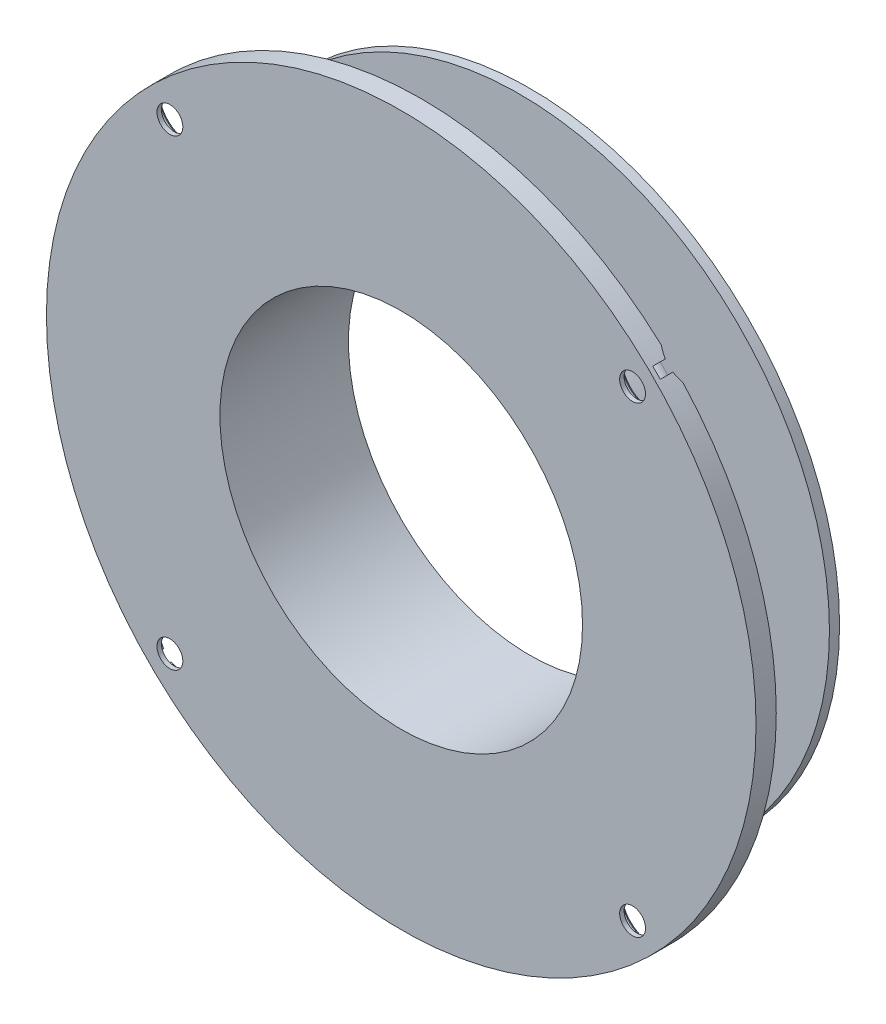
from build123d import *

# Parameters (mm, degrees)
CBORE_FOR_10_BINDING_HEAD_MACHINE_S_2_COUNT = 2
CBORE_FOR_10_BINDING_HEAD_MACHINE_S_2_PITCH = 91.44
CBORE_FOR_10_BINDING_HEAD_MACHINE_S_3_COUNT = 2
CBORE_FOR_10_BINDING_HEAD_MACHINE_S_3_PITCH = 129.315688143
CBORE_FOR_10_BINDING_HEAD_MACHINE_S_4_COUNT = 2
CBORE_FOR_10_BINDING_HEAD_MACHINE_S_4_PITCH = 91.44


with BuildPart() as part:
    # Sketch1 → Revolve1 (revolve)
    with BuildSketch(Plane(origin=(0, 0, 0), x_dir=(1, 0, 0), z_dir=(0, 1, 0)), mode=Mode.PRIVATE) as revolve1_sk:
        with BuildLine():
            Line((-1.000000064, -24.96), (-1.000000064, -10.640000064))
            ThreePointArc((-1.000000064, -10.640000064), (-1.74394884, -8.84394884), (-3.540000064, -8.100000064))
            Line((-3.540000064, -8.100000064), (-24.4, -8.100000064))
            Line((-24.4, -8.100000064), (-24.4, -6.100000064))
            Line((-24.4, -6.100000064), (-1, -6.100000064))
            Line((-1, -6.100000064), (1, -6.100000064))
            Line((1, -6.100000064), (1, -31.500000128))
            Line((1, -31.500000128), (-33.29, -31.500000128))
            Line((-33.29, -31.500000128), (-33.29, -27.5))
            Line((-33.29, -27.5), (-3.540000064, -27.5))
            ThreePointArc((-3.540000064, -27.5), (-1.74394884, -26.756051224), (-1.000000064, -24.96))
        make_face()
    revolve(revolve1_sk.sketch.rotate(Axis((36.83, 0, 32.45), (0, 0, -1)), 180), axis=Axis((36.83, 0, 32.45), (0, 0, -1)))

    # Sketch7 → CBORE for #10 Binding Head Machine Screw1 (revolve, cut)
    with BuildSketch(Plane(origin=(82.55, 45.72, 27.5), x_dir=(0, 1, 0), z_dir=(1, 0, 0))):
        Polygon((0, 0), (0, 4.000000128), (2.5527, 4.000000128), (2.5527, 3.1242), (5.55625, 3.1242), (5.55625, 0.635), (6.19125, 0), align=None)
    cbore_for_10_binding_head_machine_screw = revolve(axis=Axis((82.55, 45.72, 21.15), (0, 0, 1)), mode=Mode.SUBTRACT)

    # CBORE for _10 Binding Head Machine S 2: CBORE for #10 Binding Head Machine Screw1 ×2
    with Locations(*[(-i * CBORE_FOR_10_BINDING_HEAD_MACHINE_S_2_PITCH, 0, 0) for i in range(1, CBORE_FOR_10_BINDING_HEAD_MACHINE_S_2_COUNT)]):
        add(cbore_for_10_binding_head_machine_screw, mode=Mode.SUBTRACT)

    # CBORE for _10 Binding Head Machine S 3: CBORE for #10 Binding Head Machine Screw1 ×2
    with Locations(*[Vector(-0.7071067811865476, -0.7071067811865476, 0) * (i * CBORE_FOR_10_BINDING_HEAD_MACHINE_S_3_PITCH) for i in range(1, CBORE_FOR_10_BINDING_HEAD_MACHINE_S_3_COUNT)]):
        add(cbore_for_10_binding_head_machine_screw, mode=Mode.SUBTRACT)

    # CBORE for _10 Binding Head Machine S 4: CBORE for #10 Binding Head Machine Screw1 ×2
    with Locations(*[(0, -i * CBORE_FOR_10_BINDING_HEAD_MACHINE_S_4_PITCH, 0) for i in range(1, CBORE_FOR_10_BINDING_HEAD_MACHINE_S_4_COUNT)]):
        add(cbore_for_10_binding_head_machine_screw, mode=Mode.SUBTRACT)


solid = part.part
